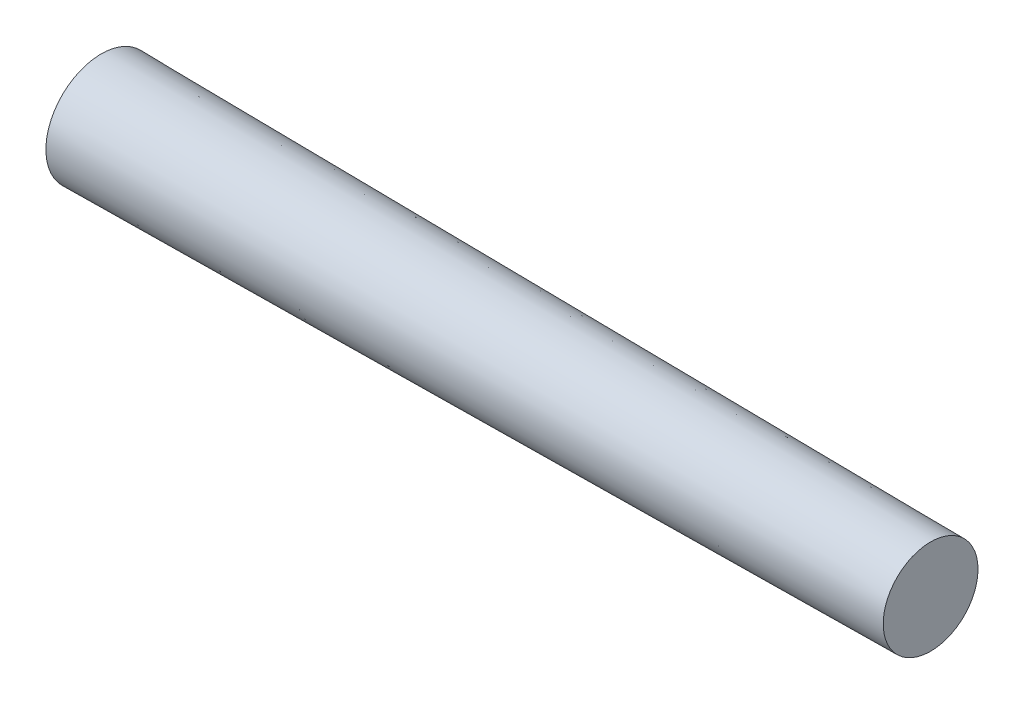
from build123d import *

# Parameters (mm, degrees)
SKETCH2_R = 6
SKETCH1_R = 7


with BuildPart() as part:
    # Sketch2 → Loft2 section 0
    with BuildSketch(Plane(origin=(105, 0, 0), x_dir=(0, 0, -1), z_dir=(1, 0, 0))):
        Circle(SKETCH2_R)
    # Sketch1 → Loft2 section 1
    with BuildSketch(Plane(origin=(0, 0, 0), x_dir=(0, 0, -1), z_dir=(1, 0, 0))):
        Circle(SKETCH1_R)
    loft()


solid = part.part
